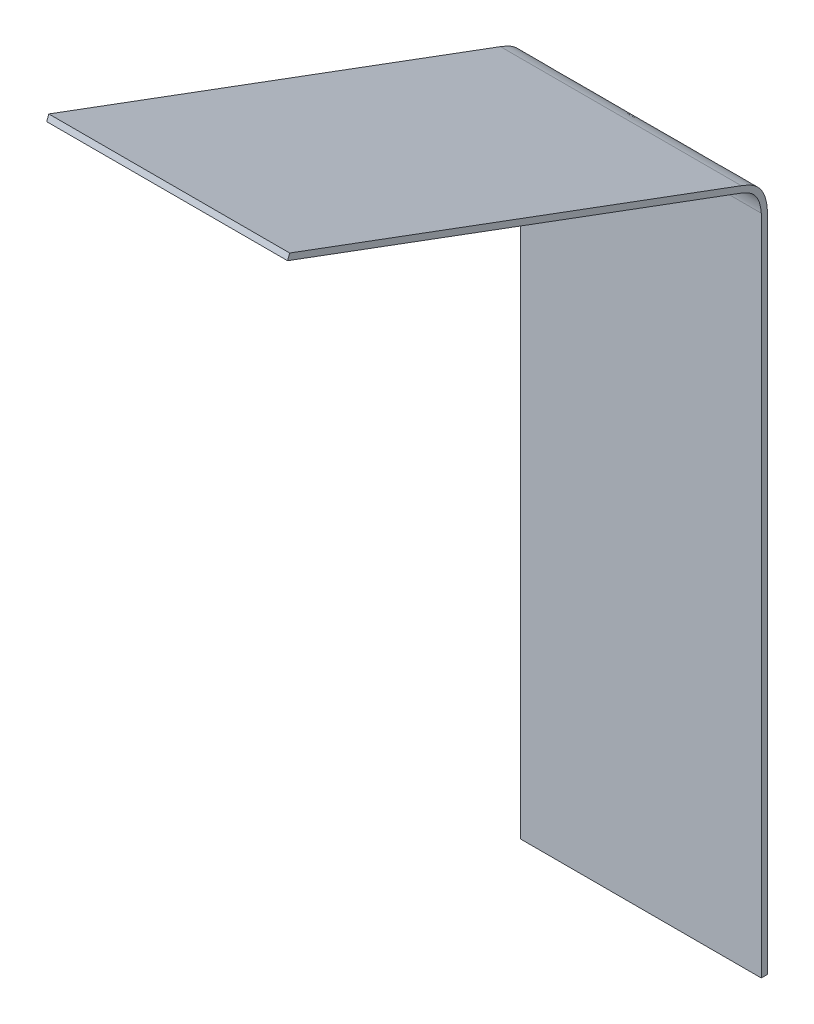
from build123d import *

# Parameters (mm, degrees)
SKETCH_1_W      = 20
SKETCH_1_H      = 55
EXTRUDE_1_DEPTH = 0.5
EXTRUDE_2_DEPTH = 20


with BuildPart() as part:
    # 草图1 → 凸台-拉伸1 (new body)
    with BuildSketch(Plane.XY):
        Rectangle(SKETCH_1_W, SKETCH_1_H)
    extrude(amount=EXTRUDE_1_DEPTH)

    # 草图2 → 凸台-拉伸2 (add)
    with BuildSketch(Plane.ZY.offset(10)):
        with BuildLine():
            Line((2.156267732, 30.305392831), (39.659750235, 44.215417999))
            Line((39.659750235, 44.215417999), (39.833625549, 43.746624468))
            Line((39.833625549, 43.746624468), (2.330143047, 29.8365993))
            add(Edge.make_bspline(
                [(0.5, 27.5), (0.5, 27.655778728), (0.711024801, 29.04730174), (1.493571631, 29.52631533), (2.330143047, 29.8365993)],
                knots=[0, 0, 0, 0, 0.26712767, 1, 1, 1, 1], degree=3))
            Line((0.5, 27.5), (0, 27.5))
            add(Edge.make_bspline(
                [(0, 27.5), (0, 27.638670788), (0.031716688, 27.88649079), (0.142334357, 28.422460253), (0.331831028, 28.912835815), (0.685759589, 29.46438852), (1.285915439, 29.952226685), (1.865336089, 30.197486413), (2.156267732, 30.305392831)],
                knots=[0, 0, 0, 0, 0.125, 0.25, 0.375, 0.5, 0.75, 1, 1, 1, 1], degree=3))
        make_face()
    extrude(amount=-EXTRUDE_2_DEPTH)


solid = part.part
